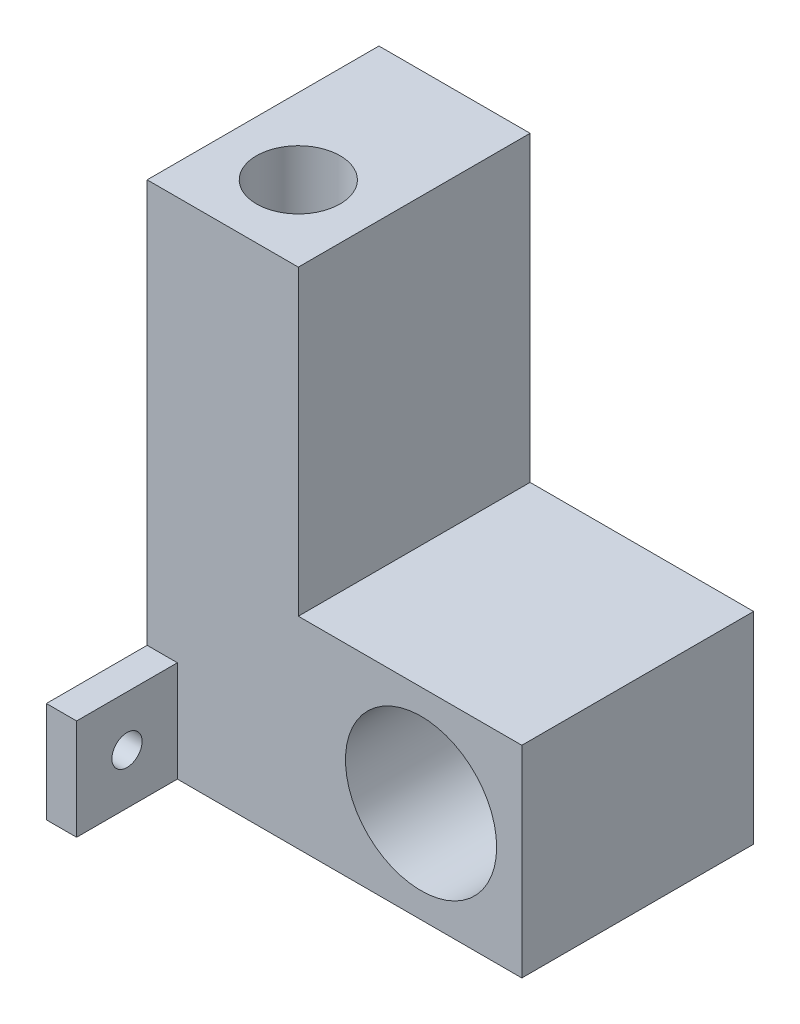
from build123d import *

# Parameters (mm, degrees)
SKETCH1_R           = 7.5
BOSS_EXTRUDE1_DEPTH = 23
SKETCH2_R           = 4.15
CUT_EXTRUDE1_DEPTH  = 62.382073123
SKETCH3_W           = 43
SKETCH3_H           = 10
SKETCH3_R           = 1.5
BOSS_EXTRUDE2_DEPTH = 3


with BuildPart() as part:
    # Sketch1 → Boss-Extrude1 (new body)
    with BuildSketch(Plane.XY):
        Polygon((-12.180119589, 10), (-12.180119589, 40), (-27.180119589, 40), (-27.180119589, -10), (10, -10), (10, 10), align=None)
        Circle(SKETCH1_R, mode=Mode.SUBTRACT)
    extrude(amount=BOSS_EXTRUDE1_DEPTH)

    # Sketch2 → Cut-Extrude1 (cut, through all)
    with BuildSketch(Plane(origin=(0, 40, 0), x_dir=(1, 0, 0), z_dir=(0, 1, 0))):
        with Locations(Location((-19.680119589, -15.5, 0), (0, 0, 270))):
            Circle(SKETCH2_R)
    extrude(amount=-CUT_EXTRUDE1_DEPTH, mode=Mode.SUBTRACT)

    # Sketch3 → Boss-Extrude2 (add)
    with BuildSketch(Plane.ZY.offset(27.180119589)):
        with Locations((11.5, -5)):
            Rectangle(SKETCH3_W, SKETCH3_H)
        with Locations((-5, -5)):
            Circle(SKETCH3_R, mode=Mode.SUBTRACT)
        with Locations((28, -5)):
            Circle(SKETCH3_R, mode=Mode.SUBTRACT)
    extrude(amount=-BOSS_EXTRUDE2_DEPTH)


solid = part.part
